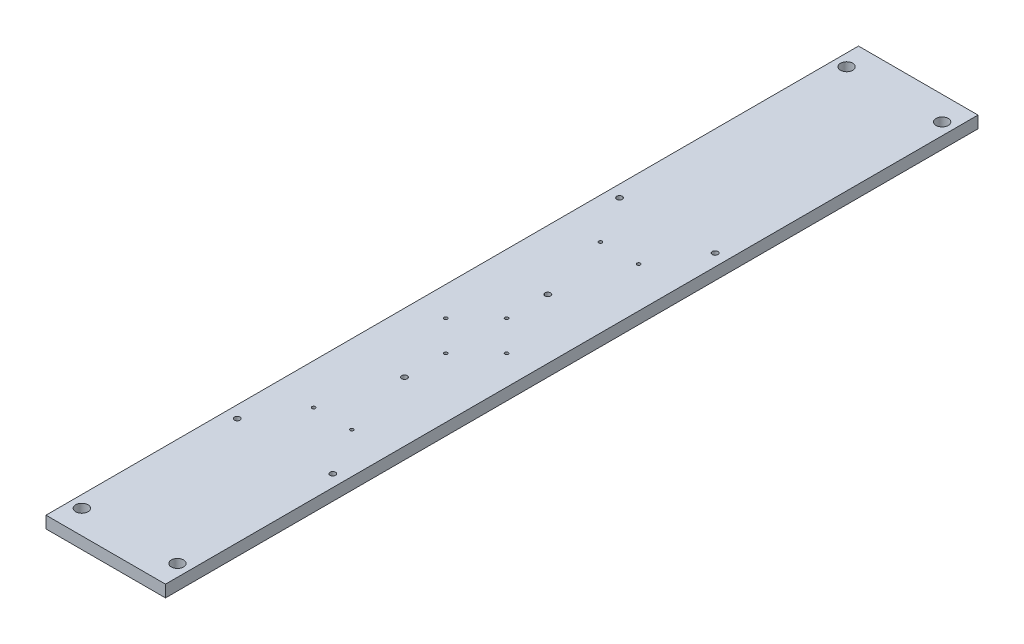
from build123d import *

# Parameters (mm, degrees)
SKETCH1_W           = 63.5
SKETCH1_H           = 431.8
BOSS_EXTRUDE1_DEPTH = 6.35
SKETCH6_R           = 3.2639
CUT_EXTRUDE9_DEPTH  = 437.490334945
SKETCH7_R           = 1.4732
CUT_EXTRUDE10_DEPTH = 437.490334945
SKETCH8_R           = 0.889
CUT_EXTRUDE11_DEPTH = 437.490334945


with BuildPart() as part:
    # Sketch1 → Boss-Extrude1 (new body)
    with BuildSketch(Plane(origin=(0, 0, 0), x_dir=(1, 0, 0), z_dir=(0, 1, 0))):
        with Locations((31.75, 215.9)):
            Rectangle(SKETCH1_W, SKETCH1_H)
    extrude(amount=BOSS_EXTRUDE1_DEPTH)

    # Sketch6 → Cut-Extrude9 (cut, through all)
    with BuildSketch(Plane(origin=(0, 6.35, 0), x_dir=(1, 0, 0), z_dir=(0, 1, 0))):
        with Locations(Location((6.35, 419.1, 0), (0, 0, 270))):
            Circle(SKETCH6_R)
        with Locations(Location((57.15, 419.1, 0), (0, 0, 90))):
            Circle(SKETCH6_R)
        with Locations(Location((57.15, 12.7, 0), (0, 0, 270))):
            Circle(SKETCH6_R)
        with Locations(Location((6.35, 12.7, 0), (0, 0, 90))):
            Circle(SKETCH6_R)
    extrude(amount=-CUT_EXTRUDE9_DEPTH, mode=Mode.SUBTRACT)

    # Sketch7 → Cut-Extrude10 (cut, through all)
    with BuildSketch(Plane(origin=(0, 6.35, 0), x_dir=(1, 0, 0), z_dir=(0, 1, 0))):
        with Locations(Location((6.35, 298.45, 0), (0, 0, 270))):
            Circle(SKETCH7_R)
        with Locations(Location((57.15, 298.45, 0), (0, 0, 90))):
            Circle(SKETCH7_R)
        with Locations(Location((57.15, 95.25, 0), (0, 0, 270))):
            Circle(SKETCH7_R)
        with Locations(Location((6.35, 95.25, 0), (0, 0, 90))):
            Circle(SKETCH7_R)
        with Locations(Location((31.75, 234.95, 0), (0, 0, 270))):
            Circle(SKETCH7_R)
        with Locations(Location((31.75, 158.75, 0), (0, 0, 90))):
            Circle(SKETCH7_R)
    extrude(amount=-CUT_EXTRUDE10_DEPTH, mode=Mode.SUBTRACT)

    # Sketch8 → Cut-Extrude11 (cut, through all)
    with BuildSketch(Plane(origin=(0, 6.35, 0), x_dir=(1, 0, 0), z_dir=(0, 1, 0))):
        with Locations(Location((15.58544, 196.85, 0), (0, 0, 270))):
            Circle(SKETCH8_R)
        with Locations(Location((31.75, 213.01456, 0), (0, 0, 270))):
            Circle(SKETCH8_R)
        with Locations(Location((47.91456, 196.85, 0), (0, 0, 270))):
            Circle(SKETCH8_R)
        with Locations(Location((31.75, 180.68544, 0), (0, 0, 270))):
            Circle(SKETCH8_R)
        with Locations(Location((21.59, 273.05, 0), (0, 0, 270))):
            Circle(SKETCH8_R)
        with Locations(Location((41.91, 273.05, 0), (0, 0, 90))):
            Circle(SKETCH8_R)
        with Locations(Location((41.91, 120.65, 0), (0, 0, 270))):
            Circle(SKETCH8_R)
        with Locations(Location((21.59, 120.65, 0), (0, 0, 90))):
            Circle(SKETCH8_R)
    extrude(amount=-CUT_EXTRUDE11_DEPTH, mode=Mode.SUBTRACT)


solid = part.part
